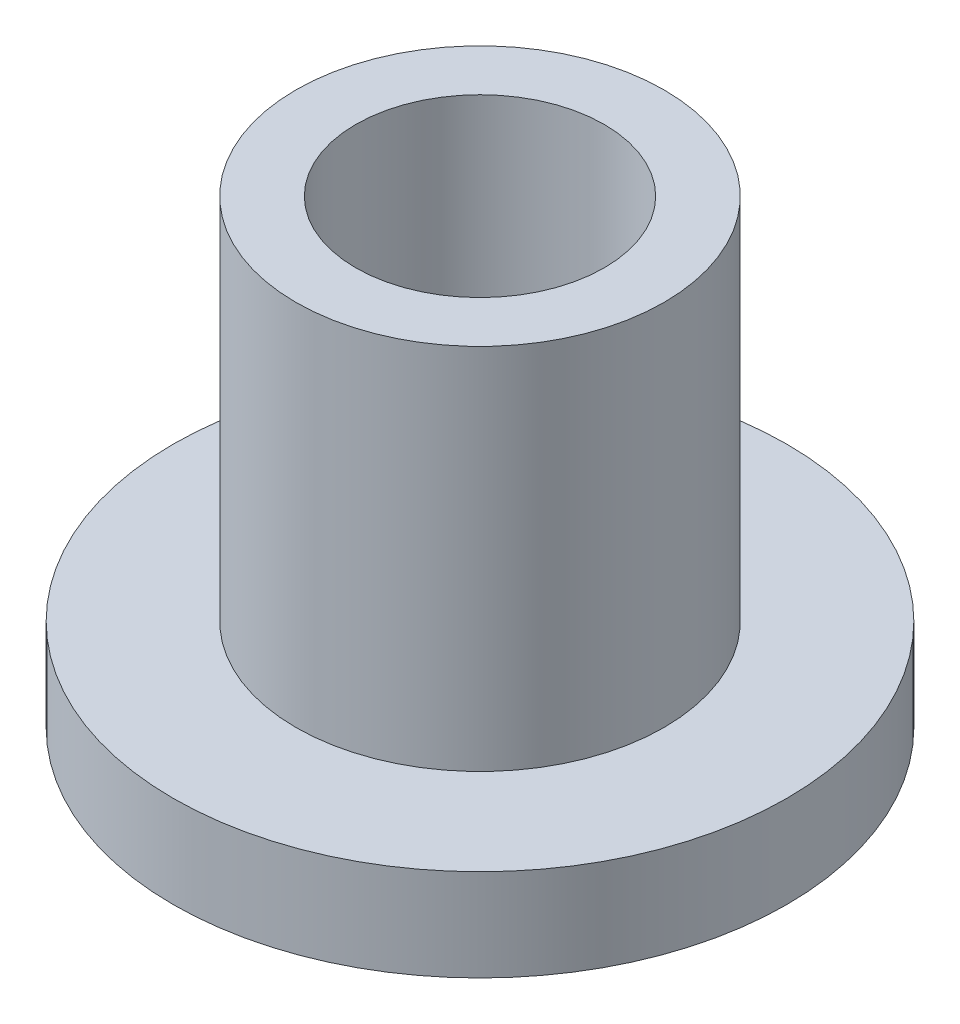
from build123d import *

# Parameters (mm, degrees)
ESBO_O1_R                = 10
RESSALTO_EXTRUS_O1_DEPTH = 3
ESBO_O2_R                = 6
RESSALTO_EXTRUS_O2_DEPTH = 12
ESBO_O3_R                = 4.05
CORTE_EXTRUS_O1_DEPTH    = 21.615528128


with BuildPart() as part:
    # Esboço1 → Ressalto-extrusão1 (new body)
    with BuildSketch(Plane(origin=(0, 0, 0), x_dir=(1, 0, 0), z_dir=(0, 1, 0))):
        with Locations(Location((0, 0, 0), (0, 0, 270))):
            Circle(ESBO_O1_R)
    extrude(amount=RESSALTO_EXTRUS_O1_DEPTH)

    # Esboço2 → Ressalto-extrusão2 (add)
    with BuildSketch(Plane(origin=(0, 3, 0), x_dir=(1, 0, 0), z_dir=(0, 1, 0))):
        with Locations(Location((0, 0, 0), (0, 0, 270))):
            Circle(ESBO_O2_R)
    extrude(amount=RESSALTO_EXTRUS_O2_DEPTH)

    # Esboço3 → Corte-extrusão1 (cut, through all)
    with BuildSketch(Plane(origin=(0, 15, 0), x_dir=(1, 0, 0), z_dir=(0, 1, 0))):
        with Locations(Location((0, 0, 0), (0, 0, 270))):
            Circle(ESBO_O3_R)
    extrude(amount=-CORTE_EXTRUS_O1_DEPTH, mode=Mode.SUBTRACT)


solid = part.part
